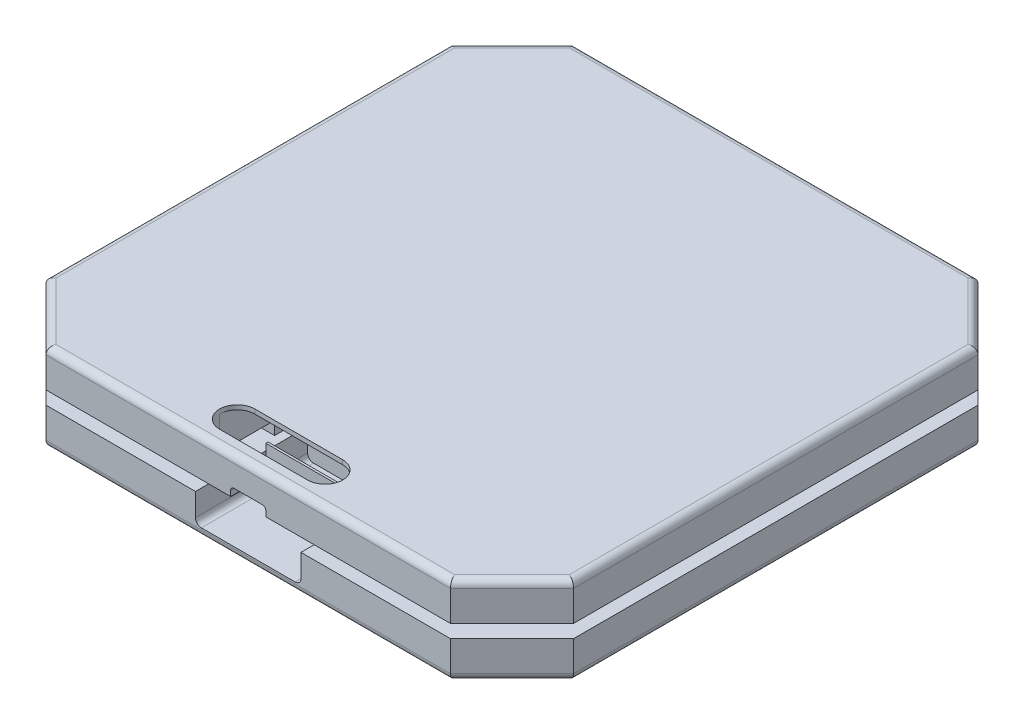
from build123d import *

# Parameters (mm, degrees)
BOSS_EXTRUDE1_DEPTH = 63.5
SKETCH3_W           = 381
SKETCH3_H           = 9.525
CUT_EXTRUDE1_DEPTH  = 63.5
SKETCH4_W           = 381
SKETCH4_H           = 9.525
CUT_EXTRUDE2_DEPTH  = 63.5
CUT_EXTRUDE3_DEPTH  = 31.75
CUT_EXTRUDE4_DEPTH  = 76.2
CUT_EXTRUDE5_DEPTH  = 57.15
CUT_EXTRUDE6_DEPTH  = 31.75
CUT_EXTRUDE7_DEPTH  = 76.2
CUT_EXTRUDE8_DEPTH  = 57.15
FILLET1_R           = 5.08
SKETCH12_W          = 50.8
SKETCH12_H          = 38.1
BOSS_EXTRUDE2_DEPTH = 1.5875
SKETCH13_R          = 11.1125
SKETCH13_R_2        = 9.525
BOSS_EXTRUDE3_DEPTH = 12.7
BOSS_EXTRUDE4_START = -6.35
SKETCH15_R          = 9.525
BOSS_EXTRUDE4_DEPTH = 6.35
SKETCH16_R          = 0.79375
BOSS_EXTRUDE5_DEPTH = 11.43
FILLET2_R           = 0.79375
SKETCH17_R          = 3.175
CUT_EXTRUDE9_DEPTH  = 25.4


with BuildPart() as part:
    # Sketch1 → Boss-Extrude1 (new body)
    with BuildSketch(Plane(origin=(0, 0, 0), x_dir=(1, 0, 0), z_dir=(0, 1, 0))):
        Polygon((-146.05, 190.5), (-190.5, 146.05), (-190.5, -146.05), (-146.05, -190.5), (146.05, -190.5), (190.5, -146.05), (190.5, 146.05), (146.05, 190.5), align=None)
    extrude(amount=BOSS_EXTRUDE1_DEPTH)

    # Sketch3 → Cut-Extrude1 (cut)
    with BuildSketch(Plane.XY.offset(190.5)):
        with Locations((0, 31.75)):
            Rectangle(SKETCH3_W, SKETCH3_H)
    cut_extrude1 = extrude(amount=-CUT_EXTRUDE1_DEPTH, mode=Mode.SUBTRACT)

    # Mirror1: Cut-Extrude1 across plane
    add(cut_extrude1.mirror(Plane.XY), mode=Mode.SUBTRACT)

    # Sketch4 → Cut-Extrude2 (cut)
    with BuildSketch(Plane.ZY.offset(190.5)):
        with Locations((0, 31.75)):
            Rectangle(SKETCH4_W, SKETCH4_H)
    cut_extrude2 = extrude(amount=-CUT_EXTRUDE2_DEPTH, mode=Mode.SUBTRACT)

    # Mirror2: Cut-Extrude2 across plane
    add(cut_extrude2.mirror(Plane(origin=(0, 0, 0), x_dir=(0, 0, 1), z_dir=(1, 0, 0))), mode=Mode.SUBTRACT)

    # Sketch5 → Cut-Extrude3 (cut)
    with BuildSketch(Plane(origin=(0, 63.5, 0), x_dir=(1, 0, 0), z_dir=(0, 1, 0))):
        with BuildLine():
            Line((31.75, -179.3875), (-31.75, -179.3875))
            ThreePointArc((-31.75, -179.3875), (-44.45, -166.6875), (-31.75, -153.9875))
            Line((-31.75, -153.9875), (31.75, -153.9875))
            ThreePointArc((31.75, -153.9875), (44.45, -166.6875), (31.75, -179.3875))
        make_face()
    extrude(amount=-CUT_EXTRUDE3_DEPTH, mode=Mode.SUBTRACT)

    # Sketch6 → Cut-Extrude4 (cut)
    with BuildSketch(Plane.XY.offset(190.5)):
        with BuildLine():
            Line((-38.1, 26.9875), (38.1, 26.9875))
            Line((38.1, 26.9875), (38.1, 10.583333333))
            ThreePointArc((38.1, 10.583333333), (36.860085374, 7.589914626), (33.866666667, 6.35))
            Line((33.866666667, 6.35), (-33.866666667, 6.35))
            ThreePointArc((-33.866666667, 6.35), (-36.860085374, 7.589914626), (-38.1, 10.583333333))
            Line((-38.1, 10.583333333), (-38.1, 26.9875))
        make_face()
        with BuildLine():
            Line((-12.7, 36.5125), (12.7, 36.5125))
            Line((12.7, 36.5125), (12.7, 40.3225))
            ThreePointArc((12.7, 40.3225), (11.956051224, 42.118551224), (10.16, 42.8625))
            Line((10.16, 42.8625), (-10.16, 42.8625))
            ThreePointArc((-10.16, 42.8625), (-11.956051224, 42.118551224), (-12.7, 40.3225))
            Line((-12.7, 40.3225), (-12.7, 36.5125))
        make_face()
    extrude(amount=-CUT_EXTRUDE4_DEPTH, mode=Mode.SUBTRACT)

    # Sketch7 → Cut-Extrude5 (cut)
    with BuildSketch(Plane.XY.offset(166.6875)):
        with BuildLine():
            Line((-44.45, 26.9875), (-38.1, 26.9875))
            Line((-38.1, 26.9875), (-38.1, 10.583333333))
            ThreePointArc((-38.1, 10.583333333), (-36.860085374, 7.589914626), (-33.866666667, 6.35))
            Line((-33.866666667, 6.35), (33.866666667, 6.35))
            ThreePointArc((33.866666667, 6.35), (36.860085374, 7.589914626), (38.1, 10.583333333))
            Line((38.1, 10.583333333), (38.1, 26.9875))
            Line((38.1, 26.9875), (44.45, 26.9875))
            Line((44.45, 26.9875), (44.45, 60.325))
            Line((44.45, 60.325), (-44.45, 60.325))
            Line((-44.45, 60.325), (-44.45, 26.9875))
        make_face()
    extrude(amount=-CUT_EXTRUDE5_DEPTH, mode=Mode.SUBTRACT)

    # Sketch8 → Cut-Extrude6 (cut)
    with BuildSketch(Plane.XZ):
        with BuildLine():
            Line((31.75, -179.3875), (-31.75, -179.3875))
            ThreePointArc((-31.75, -179.3875), (-44.45, -166.6875), (-31.75, -153.9875))
            Line((-31.75, -153.9875), (31.75, -153.9875))
            ThreePointArc((31.75, -153.9875), (44.45, -166.6875), (31.75, -179.3875))
        make_face()
    extrude(amount=-CUT_EXTRUDE6_DEPTH, mode=Mode.SUBTRACT)

    # Sketch9 → Cut-Extrude7 (cut)
    with BuildSketch(Plane(origin=(0, 0, -190.5), x_dir=(-1, 0, 0), z_dir=(0, 0, -1))):
        with BuildLine():
            Line((33.866666667, 57.15), (-33.866666667, 57.15))
            ThreePointArc((-33.866666667, 57.15), (-36.860085374, 55.910085374), (-38.1, 52.916666667))
            Line((-38.1, 52.916666667), (-38.1, 36.5125))
            Line((-38.1, 36.5125), (38.1, 36.5125))
            Line((38.1, 36.5125), (38.1, 52.916666667))
            ThreePointArc((38.1, 52.916666667), (36.860085374, 55.910085374), (33.866666667, 57.15))
        make_face()
        with BuildLine():
            Line((10.16, 20.6375), (-10.16, 20.6375))
            ThreePointArc((-10.16, 20.6375), (-11.956051224, 21.381448776), (-12.7, 23.1775))
            Line((-12.7, 23.1775), (-12.7, 26.9875))
            Line((-12.7, 26.9875), (12.7, 26.9875))
            Line((12.7, 26.9875), (12.7, 23.1775))
            ThreePointArc((12.7, 23.1775), (11.956051224, 21.381448776), (10.16, 20.6375))
        make_face()
    extrude(amount=-CUT_EXTRUDE7_DEPTH, mode=Mode.SUBTRACT)

    # Sketch10 → Cut-Extrude8 (cut)
    with BuildSketch(Plane(origin=(0, 0, -166.6875), x_dir=(-1, 0, 0), z_dir=(0, 0, -1))):
        with BuildLine():
            Line((-44.45, 3.175), (44.45, 3.175))
            Line((44.45, 3.175), (44.45, 36.5125))
            Line((44.45, 36.5125), (38.1, 36.5125))
            Line((38.1, 36.5125), (38.1, 52.916666667))
            ThreePointArc((38.1, 52.916666667), (36.860085374, 55.910085374), (33.866666667, 57.15))
            Line((33.866666667, 57.15), (-33.866666667, 57.15))
            ThreePointArc((-33.866666667, 57.15), (-36.860085374, 55.910085374), (-38.1, 52.916666667))
            Line((-38.1, 52.916666667), (-38.1, 36.5125))
            Line((-38.1, 36.5125), (-44.45, 36.5125))
            Line((-44.45, 36.5125), (-44.45, 3.175))
        make_face()
    extrude(amount=-CUT_EXTRUDE8_DEPTH, mode=Mode.SUBTRACT)

    # Fillet1
    fillet1_edges = [part.edges().sort_by_distance(p)[0] for p in [
        (-168.275, 0, -168.275),
        (0, 0, -190.5),
        (168.275, 0, -168.275),
        (190.5, 0, 0),
        (168.275, 0, 168.275),
        (-190.5, 0, 0),
        (-168.275, 0, 168.275),
        (0, 0, 190.5),
        (168.275, 63.5, -168.275),
        (0, 63.5, -190.5),
        (-168.275, 63.5, -168.275),
        (190.5, 63.5, 0),
        (168.275, 63.5, 168.275),
        (0, 63.5, 190.5),
        (-168.275, 63.5, 168.275),
        (-190.5, 63.5, 0),
    ]]
    fillet(fillet1_edges, radius=FILLET1_R)

    # Sketch12 → Boss-Extrude2 (add)
    with BuildSketch(Plane.XY.offset(152.4)):
        with Locations((0, 25.4)):
            Rectangle(SKETCH12_W, SKETCH12_H)
    extrude(amount=-BOSS_EXTRUDE2_DEPTH)

    # Sketch13 → Boss-Extrude3 (add)
    with BuildSketch(Plane.XY.offset(152.4)):
        with Locations((0, 25.4)):
            Circle(SKETCH13_R)
        with Locations((0, 25.4)):
            Circle(SKETCH13_R_2, mode=Mode.SUBTRACT)
    extrude(amount=BOSS_EXTRUDE3_DEPTH)

    # Sketch15 → Boss-Extrude4 (add)
    with BuildSketch(Plane.XY.offset(152.4).offset(BOSS_EXTRUDE4_START)):
        with Locations((0, 25.4)):
            Circle(SKETCH15_R)
    extrude(amount=BOSS_EXTRUDE4_DEPTH)

    # Sketch16 → Boss-Extrude5 (add)
    with BuildSketch(Plane.XY.offset(152.4)):
        with Locations((2.694076836, 28.094076836)):
            Circle(SKETCH16_R)
        with Locations((-2.694076836, 28.094076836)):
            Circle(SKETCH16_R)
        with Locations((-2.694076836, 22.705923164)):
            Circle(SKETCH16_R)
        with Locations((2.694076836, 22.705923164)):
            Circle(SKETCH16_R)
    extrude(amount=BOSS_EXTRUDE5_DEPTH)

    # Fillet2
    fillet2_edges = [part.edges().sort_by_distance(p)[0] for p in [
        (-3.487826836, 22.705923164, 163.83),
        (1.900326836, 22.705923164, 163.83),
        (1.900326836, 28.094076836, 163.83),
        (-3.487826836, 28.094076836, 163.83),
    ]]
    fillet(fillet2_edges, radius=FILLET2_R)

    # Sketch17 → Cut-Extrude9 (cut)
    with BuildSketch(Plane.XZ):
        with Locations((165.1, 0)):
            Circle(SKETCH17_R)
        with Locations((-165.1, 0)):
            Circle(SKETCH17_R)
    extrude(amount=-CUT_EXTRUDE9_DEPTH, mode=Mode.SUBTRACT)


solid = part.part
